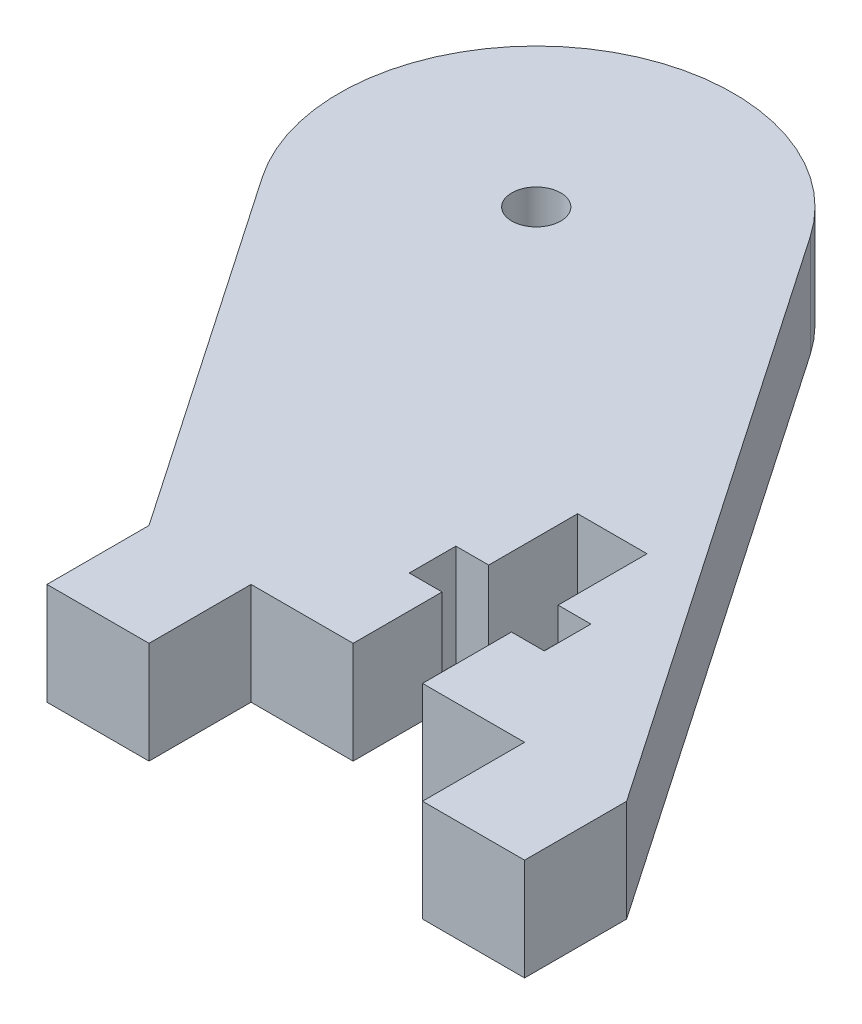
from build123d import *

# Parameters (mm, degrees)
SKETCH1_R           = 1.524
BOSS_EXTRUDE1_DEPTH = 6.35


with BuildPart() as part:
    # Sketch1 → Boss-Extrude1 (new body)
    with BuildSketch(Plane(origin=(0, 0, 0), x_dir=(1, 0, 0), z_dir=(0, 1, 0))):
        with BuildLine():
            Line((-15.24, 22.286579861), (0, 0))
            Line((0, 0), (0, -6.35))
            Line((0, -6.35), (6.35, -6.35))
            Line((6.35, -6.35), (6.35, 0))
            Line((6.35, 0), (12.7, 0))
            Line((12.7, 0), (12.7, 5.534999979))
            Line((12.7, 5.534999979), (10.659000018, 5.534999979))
            Line((10.659000018, 5.534999979), (10.659000018, 8.435000021))
            Line((10.659000018, 8.435000021), (12.7, 8.435000021))
            Line((12.7, 8.435000021), (12.7, 13.97))
            Line((12.7, 13.97), (17.018, 13.97))
            Line((17.018, 13.97), (17.018, 8.435000021))
            Line((17.018, 8.435000021), (19.058999982, 8.435000021))
            Line((19.058999982, 8.435000021), (19.058999982, 5.534999979))
            Line((19.058999982, 5.534999979), (17.018, 5.534999979))
            Line((17.018, 5.534999979), (17.018, 0))
            Line((17.018, 0), (23.368, 0))
            Line((23.368, 0), (23.368, -6.35))
            Line((23.368, -6.35), (29.718, -6.35))
            Line((29.718, -6.35), (29.718, 0))
            Line((29.718, 0), (5.009259297, 36.133420139))
            ThreePointArc((5.009259297, 36.133420139), (-12.038790491, 39.334629649), (-15.24, 22.286579861))
        make_face()
        with Locations((-5.115370351, 29.21)):
            Circle(SKETCH1_R, mode=Mode.SUBTRACT)
    extrude(amount=BOSS_EXTRUDE1_DEPTH)


solid = part.part
